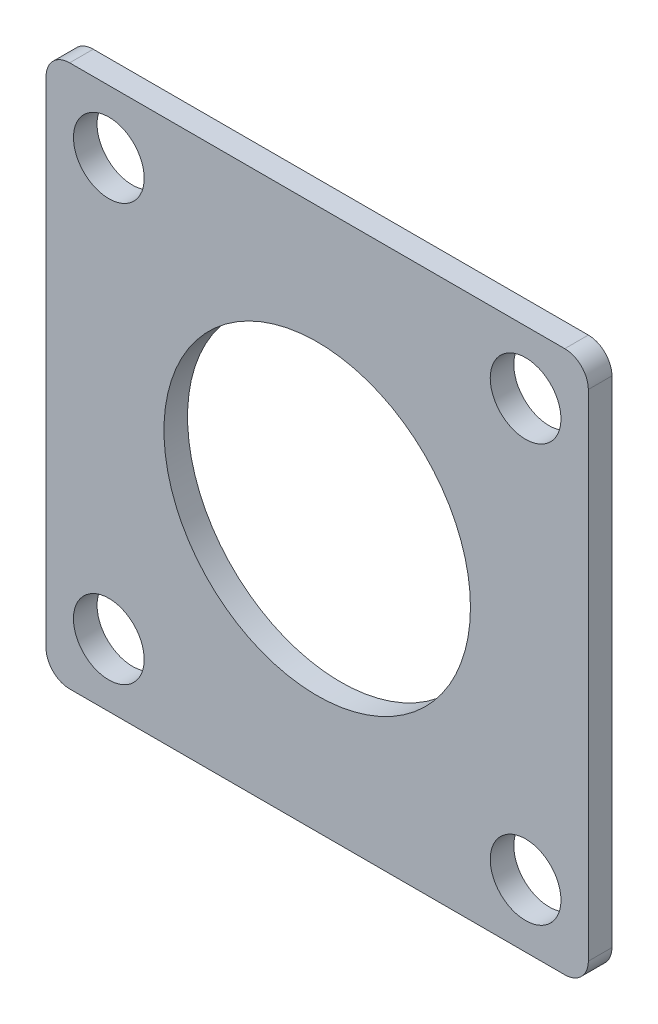
from build123d import *

# Parameters (mm, degrees)
SKETCH_1_W      = 23
SKETCH_1_H      = 23
SKETCH_1_R      = 1.5
SKETCH_1_R_2    = 6.5
EXTRUDE_1_DEPTH = 1
FILLET_1_R      = 1


with BuildPart() as part:
    # 草图1 → 凸台-拉伸1 (new body)
    with BuildSketch(Plane.XY):
        Rectangle(SKETCH_1_W, SKETCH_1_H)
        with Locations((-8.838834765, 8.838834765)):
            Circle(SKETCH_1_R, mode=Mode.SUBTRACT)
        with Locations(Location((-8.838834765, -8.838834765, 0), (0, 0, 180))):
            Circle(SKETCH_1_R, mode=Mode.SUBTRACT)
        with Locations((8.838834765, -8.838834765)):
            Circle(SKETCH_1_R, mode=Mode.SUBTRACT)
        with Locations(Location((8.838834765, 8.838834765, 0), (0, 0, 180))):
            Circle(SKETCH_1_R, mode=Mode.SUBTRACT)
        Circle(SKETCH_1_R_2, mode=Mode.SUBTRACT)
    extrude(amount=EXTRUDE_1_DEPTH)

    # 圆角1
    fillet_1_edges = [part.edges().sort_by_distance(p)[0] for p in [
        (-11.5, 11.5, 0.5),
        (11.5, 11.5, 0.5),
        (11.5, -11.5, 0.5),
        (-11.5, -11.5, 0.5),
    ]]
    fillet(fillet_1_edges, radius=FILLET_1_R)


solid = part.part
